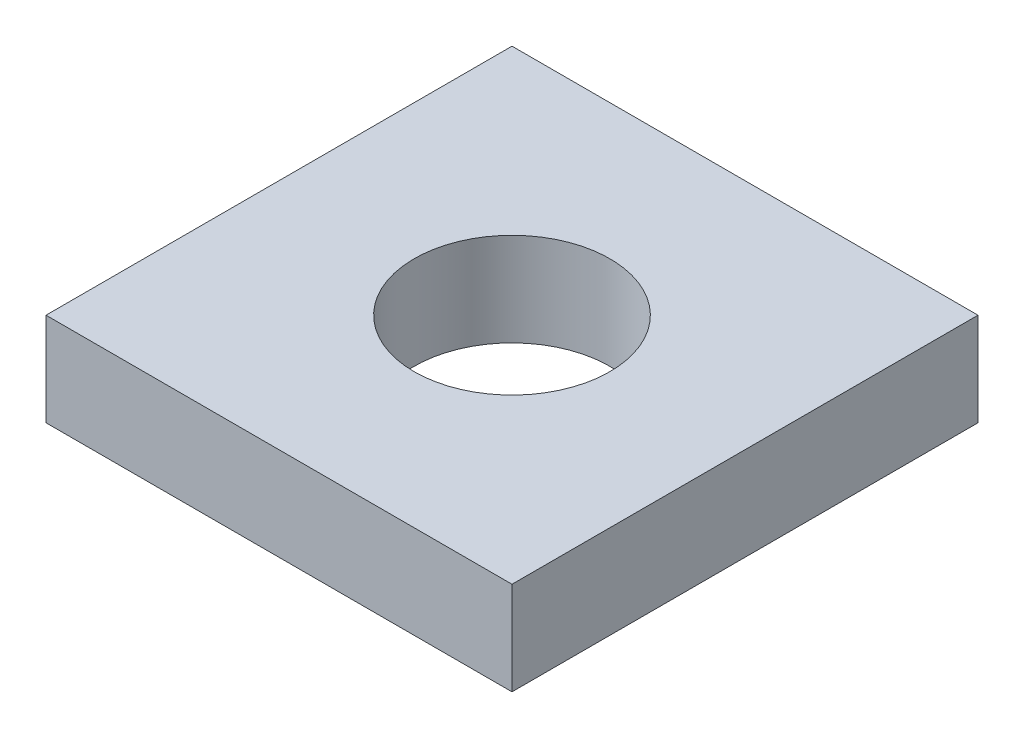
from build123d import *

# Parameters (mm, degrees)
SKETCH1_W           = 10
SKETCH1_H           = 10
SKETCH1_R           = 2.1
BOSS_EXTRUDE1_DEPTH = 2


with BuildPart() as part:
    # Sketch1 → Boss-Extrude1 (new body)
    with BuildSketch(Plane(origin=(0, 0, 0), x_dir=(1, 0, 0), z_dir=(0, 1, 0))):
        with Locations((5, 5)):
            Rectangle(SKETCH1_W, SKETCH1_H)
        with Locations(Location((5, 5, 0), (0, 0, 270))):
            Circle(SKETCH1_R, mode=Mode.SUBTRACT)
    extrude(amount=BOSS_EXTRUDE1_DEPTH)


solid = part.part
